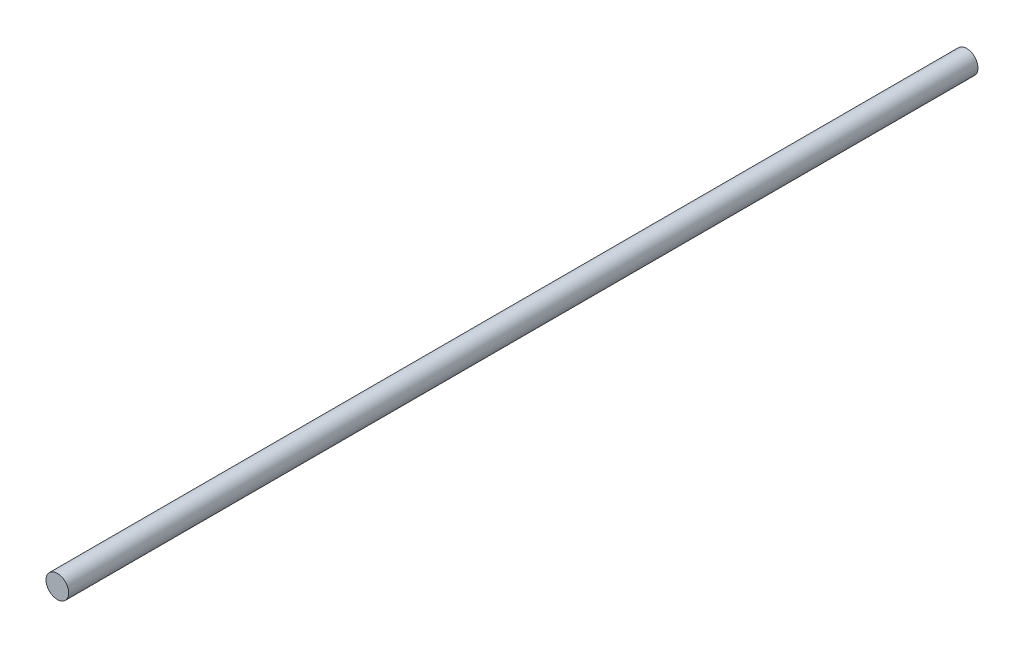
from build123d import *

# Parameters (mm, degrees)
CROQUIS1_R              = 12.5
SALIENTE_EXTRUIR1_DEPTH = 500


with BuildPart() as part:
    # Croquis1 → Saliente-Extruir1 (new, symmetric)
    with BuildSketch(Plane.XY):
        Circle(CROQUIS1_R)
    extrude(amount=SALIENTE_EXTRUIR1_DEPTH, both=True)


solid = part.part
